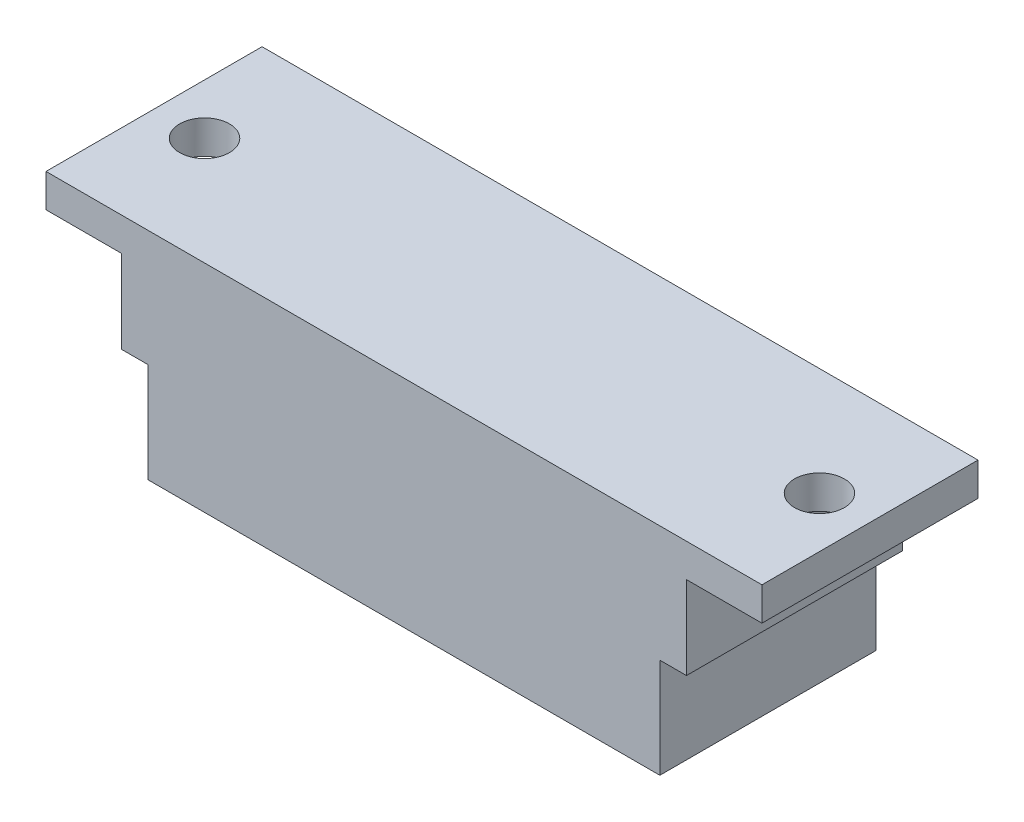
from build123d import *

# Parameters (mm, degrees)
EXTRUDE_1_DEPTH     = 13
SKETCH_2_R          = 1.5
CUT_EXTRUDE_1_DEPTH = 29.319615638


with BuildPart() as part:
    # 草图1 → 凸台-拉伸1 (new body)
    with BuildSketch(Plane.XY):
        Polygon((-21.540673849, 5.291964376), (21.540673849, 5.291964376), (21.540673849, 3.291964376), (16.999577959, 3.291964376), (16.999577959, -1.708035624), (15.396838233, -1.708035624), (15.396838233, -7.708035624), (-15.396838233, -7.708035624), (-15.396838233, -1.708035624), (-16.999577959, -1.708035624), (-16.999577959, 3.291964376), (-21.540673849, 3.291964376), align=None)
    extrude(amount=EXTRUDE_1_DEPTH)

    # 草图2 → 切除-拉伸1 (cut, through all)
    with BuildSketch(Plane(origin=(0, 5.291964376, 0), x_dir=(1, 0, 0), z_dir=(0, 1, 0))):
        with Locations(Location((-18.5, -6.5, 0), (0, 0, 270))):
            Circle(SKETCH_2_R)
        with Locations(Location((18.5, -6.5, 0), (0, 0, 180))):
            Circle(SKETCH_2_R)
    extrude(amount=-CUT_EXTRUDE_1_DEPTH, mode=Mode.SUBTRACT)


solid = part.part
